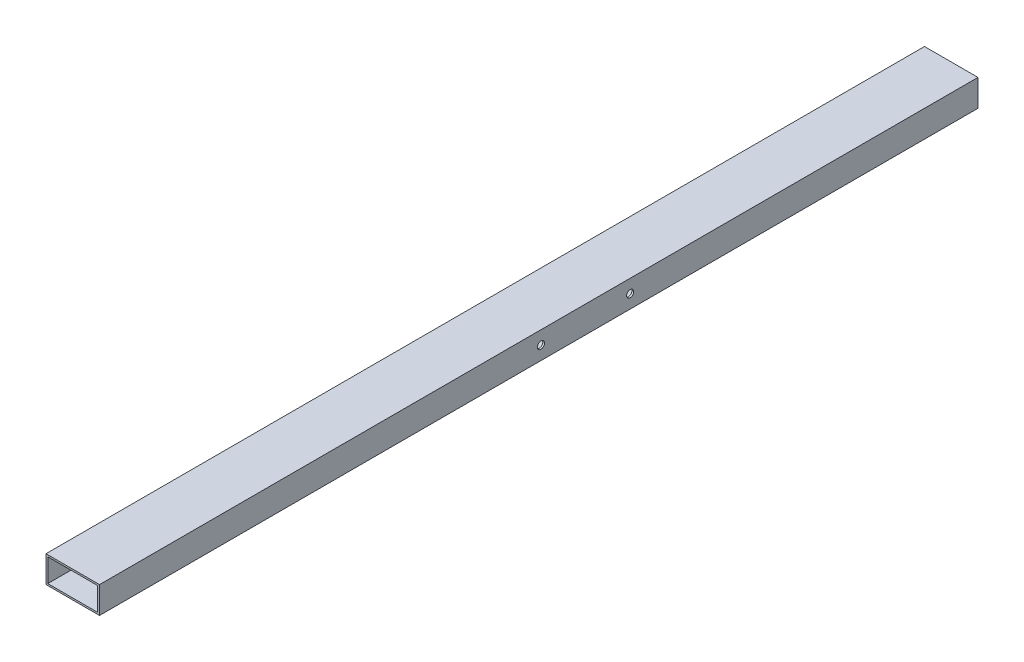
from build123d import *

# Parameters (mm, degrees)
CROQUIS1_W              = 60
CROQUIS1_H              = 30
CROQUIS1_W_2            = 56
CROQUIS1_H_2            = 26
SALIENTE_EXTRUIR1_DEPTH = 985
CROQUIS2_R              = 4
CORTAR_EXTRUIR1_DEPTH   = 987.939714471


with BuildPart() as part:
    # Croquis1 → Saliente-Extruir1 (new body)
    with BuildSketch(Plane.XY):
        Rectangle(CROQUIS1_W, CROQUIS1_H)
        Rectangle(CROQUIS1_W_2, CROQUIS1_H_2, mode=Mode.SUBTRACT)
    extrude(amount=SALIENTE_EXTRUIR1_DEPTH)

    # Croquis2 → Cortar-Extruir1 (cut, through all)
    with BuildSketch(Plane(origin=(30, 0, 0), x_dir=(0, 0, -1), z_dir=(1, 0, 0))):
        with Locations((-390, 0)):
            Circle(CROQUIS2_R)
        with Locations((-490, 0)):
            Circle(CROQUIS2_R)
    extrude(amount=-CORTAR_EXTRUIR1_DEPTH, mode=Mode.SUBTRACT)


solid = part.part
